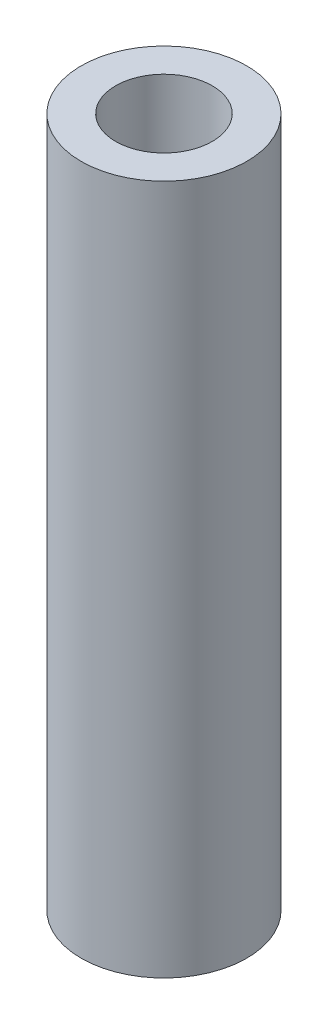
from build123d import *

# Parameters (mm, degrees)
SKETCH_1_R      = 6
SKETCH_1_R_2    = 3.5
EXTRUDE_1_DEPTH = 50


with BuildPart() as part:
    # Эскиз1 → Бобышка-Вытянуть1 (new body)
    with BuildSketch(Plane(origin=(0, 0, 0), x_dir=(1, 0, 0), z_dir=(0, 1, 0))):
        with Locations(Location((0, 0, 0), (0, 0, 270))):
            Circle(SKETCH_1_R)
        with Locations(Location((0, 0, 0), (0, 0, 270))):
            Circle(SKETCH_1_R_2, mode=Mode.SUBTRACT)
    extrude(amount=EXTRUDE_1_DEPTH)


solid = part.part
